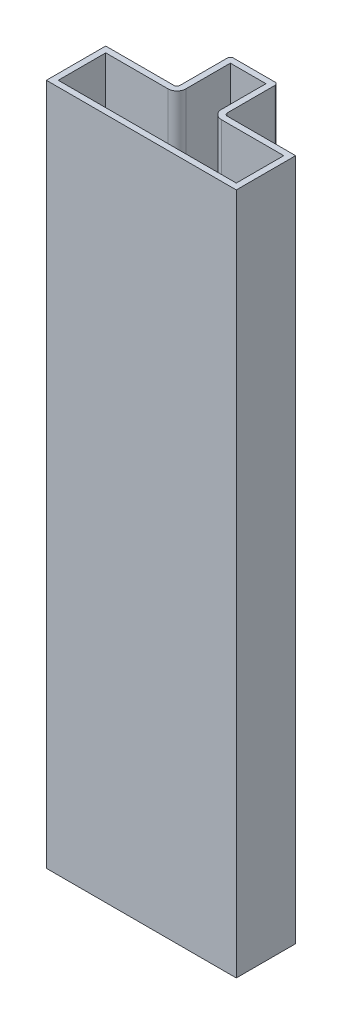
from build123d import *

# Parameters (mm, degrees)
BOSS_EXTRUDE1_DEPTH      = 115
FILLET1_R                = 0.5
SHELL1_T                 = -1
SHELL1_THICKNESS_2_DEPTH = 89
SKETCH2_W                = 3
SKETCH2_H                = 4
CUT_EXTRUDE1_DEPTH       = 3


with BuildPart() as part:
    # Sketch1 → Boss-Extrude1 (new body)
    with BuildSketch(Plane(origin=(0, 0, 0), x_dir=(1, 0, 0), z_dir=(0, 1, 0))):
        Polygon((0, 0), (32, 0), (32, 10), (20, 10), (20, 19), (12, 19), (12, 10), (0, 10), align=None)
    extrude(amount=BOSS_EXTRUDE1_DEPTH)

    # Fillet1
    fillet1_edges = [part.edges().sort_by_distance(p)[0] for p in [
        (12, 57.5, -10),
        (12, 57.5, -19),
        (20, 57.5, -19),
        (20, 57.5, -10),
    ]]
    fillet(fillet1_edges, radius=FILLET1_R)

    # Shell1
    shell1_openings = [part.faces().sort_by_distance(p)[0] for p in [
        (16, 115, -6.742495559),
    ]]
    offset(amount=SHELL1_T, openings=shell1_openings)

    # Shell1 thickness 2 face (on inner face of the shell) → Shell1 thickness 2 (add)
    with BuildSketch(Plane(origin=(16, 1, -6.570305912), x_dir=(0, 0, -1), z_dir=(0, -1, 0))):
        with BuildLine():
            ThreePointArc((2.429694088, 4.5), (2.869033916, 3.439339828), (3.929694088, 3))
            Line((3.929694088, 3), (11.429694088, 3))
            Line((11.429694088, 3), (11.429694088, -3))
            Line((11.429694088, -3), (3.929694088, -3))
            ThreePointArc((3.929694088, -3), (2.869033916, -3.439339828), (2.429694088, -4.5))
            Line((2.429694088, -4.5), (2.429694088, -15))
            Line((2.429694088, -15), (-5.570305912, -15))
            Line((-5.570305912, -15), (-5.570305912, 15))
            Line((-5.570305912, 15), (2.429694088, 15))
            Line((2.429694088, 15), (2.429694088, 4.5))
        make_face()
    extrude(amount=-SHELL1_THICKNESS_2_DEPTH)

    # Sketch2 → Cut-Extrude1 (cut)
    with BuildSketch(Plane.XZ):
        with Locations((16, -5)):
            Rectangle(SKETCH2_W, SKETCH2_H)
    extrude(amount=-CUT_EXTRUDE1_DEPTH, mode=Mode.SUBTRACT)


solid = part.part
